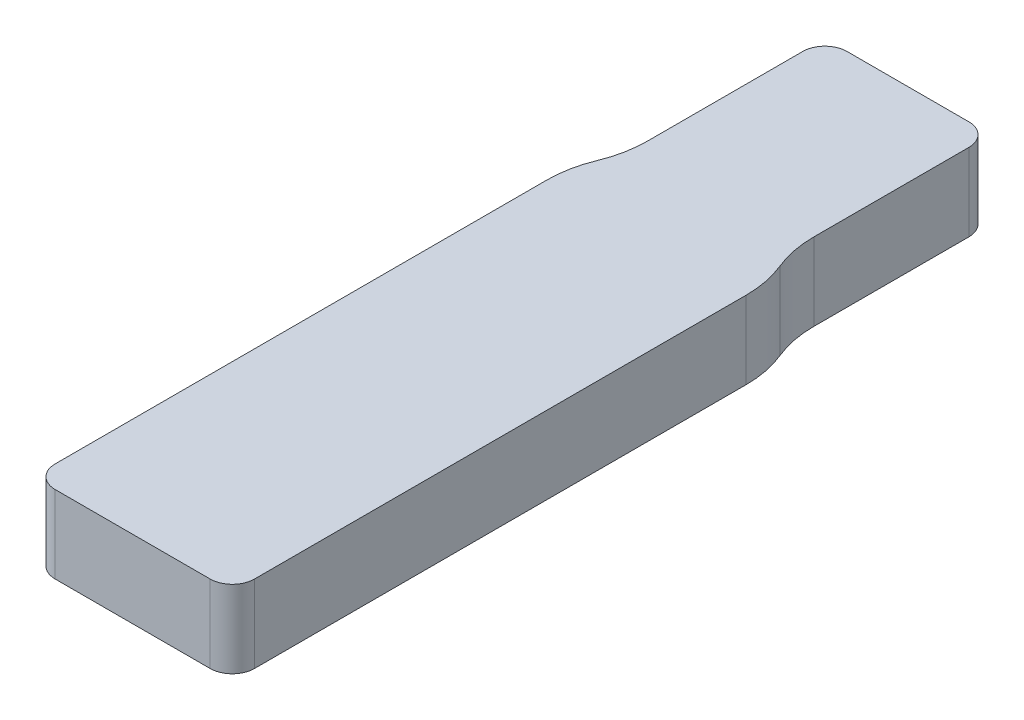
from build123d import *

# Parameters (mm, degrees)
EXTRUDE_1_DEPTH = 7


with BuildPart() as part:
    # 草图2 → 凸台-拉伸1 (new body)
    with BuildSketch(Plane(origin=(0, 0, 0), x_dir=(1, 0, 0), z_dir=(0, 1, 0))):
        with BuildLine():
            Line((0, 0), (7, 0))
            ThreePointArc((7, 0), (8.414213562, 0.585786438), (9, 2))
            Line((9, 2), (9, 46.39280404))
            ThreePointArc((9, 46.39280404), (8.811088093, 48.327371287), (8.251489914, 50.188845976))
            ThreePointArc((8.251489914, 50.188845976), (7.689663967, 52.057731217), (7.5, 53.999999998))
            Line((7.5, 53.999999998), (7.5, 67.999999998))
            ThreePointArc((7.5, 67.999999998), (6.914213562, 69.41421356), (5.5, 69.999999998))
            Line((5.5, 69.999999998), (0, 69.999999998))
            Line((0, 69.999999998), (-5.5, 69.999999998))
            ThreePointArc((-5.5, 69.999999998), (-6.914213562, 69.41421356), (-7.5, 67.999999998))
            Line((-7.5, 67.999999998), (-7.5, 53.999999998))
            ThreePointArc((-7.5, 53.999999998), (-7.689663967, 52.057731217), (-8.251489914, 50.188845976))
            ThreePointArc((-8.251489914, 50.188845976), (-8.811088093, 48.327371287), (-9, 46.39280404))
            Line((-9, 46.39280404), (-9, 2))
            ThreePointArc((-9, 2), (-8.414213562, 0.585786438), (-7, 0))
            Line((-7, 0), (0, 0))
        make_face()
    extrude(amount=EXTRUDE_1_DEPTH)


solid = part.part
